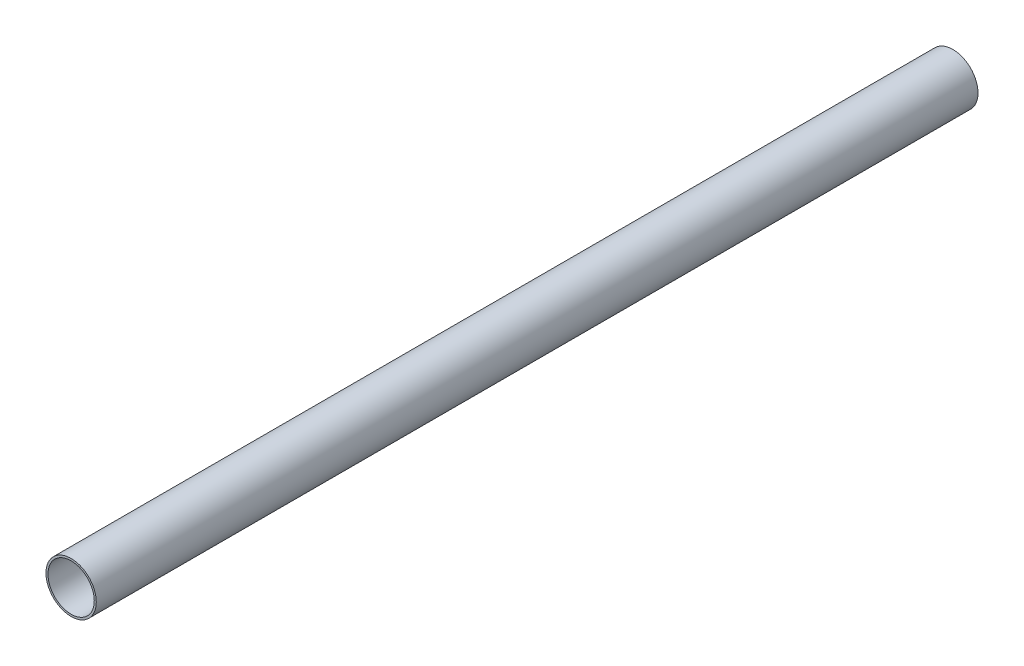
from build123d import *

# Parameters (mm, degrees)
SKETCH_1_R      = 12.5
SKETCH_1_R_2    = 11.5
EXTRUDE_1_DEPTH = 219


with BuildPart() as part:
    # 草图1 → 凸台-拉伸1 (new, symmetric)
    with BuildSketch(Plane.XY):
        Circle(SKETCH_1_R)
        Circle(SKETCH_1_R_2, mode=Mode.SUBTRACT)
    extrude(amount=EXTRUDE_1_DEPTH, both=True)


solid = part.part
